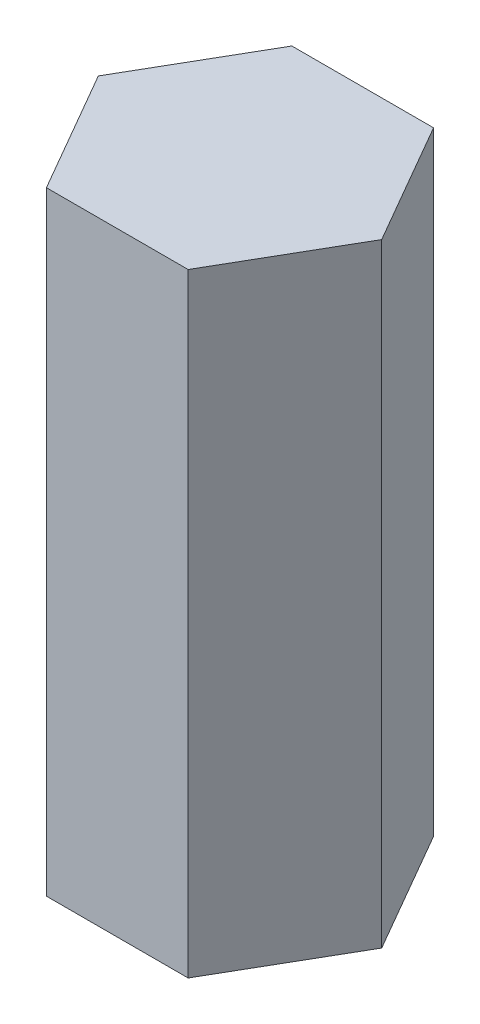
from build123d import *

# Parameters (mm, degrees)
BOSS_EXTRUDE1_DEPTH = 14


with BuildPart() as part:
    # Sketch1 → Boss-Extrude1 (new body)
    with BuildSketch(Plane(origin=(0, 0, 0), x_dir=(1, 0, 0), z_dir=(0, 1, 0))):
        Polygon((1.616580754, 2.8), (-1.616580754, 2.8), (-3.233161507, 0), (-1.616580754, -2.8), (1.616580754, -2.8), (3.233161507, 0), align=None)
    extrude(amount=BOSS_EXTRUDE1_DEPTH)


solid = part.part
